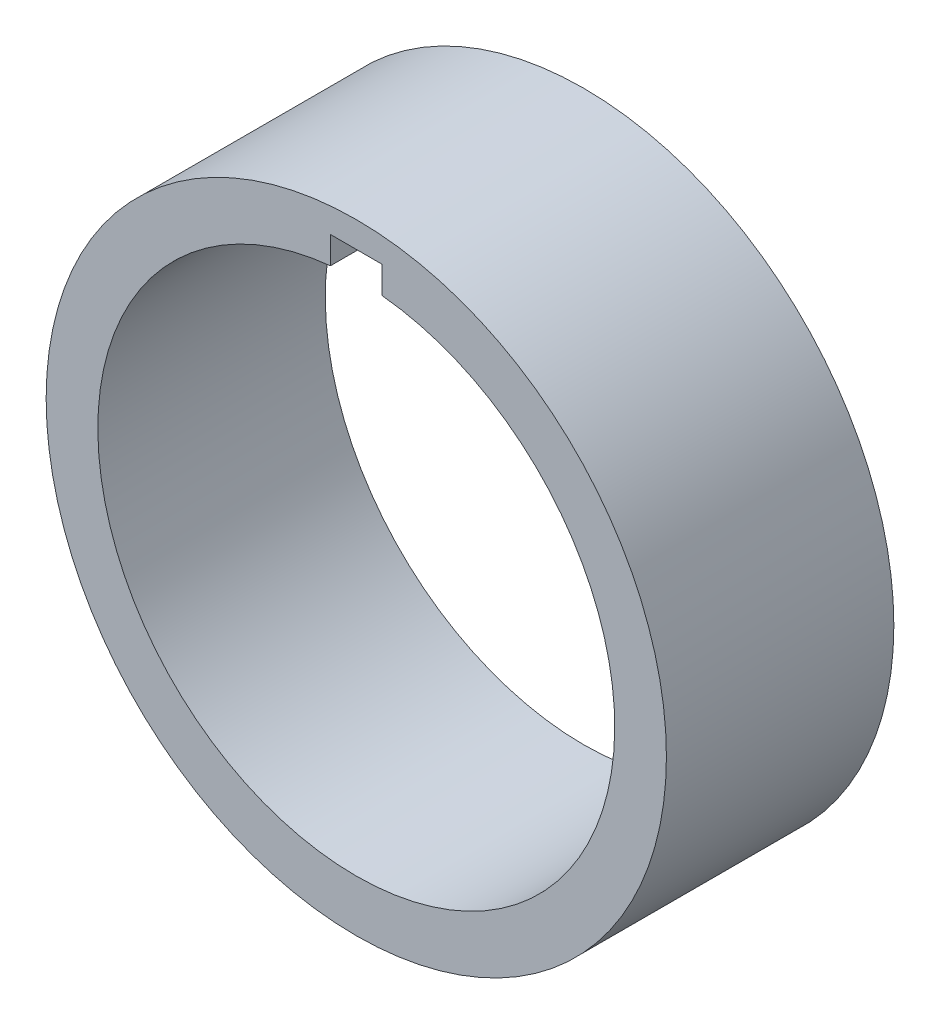
from build123d import *

# Parameters (mm, degrees)
SKETCH1_R           = 30
BOSS_EXTRUDE1_DEPTH = 22


with BuildPart() as part:
    # Sketch1 → Boss-Extrude1 (new body)
    with BuildSketch(Plane.XY):
        Circle(SKETCH1_R)
        with BuildLine():
            Line((-2.5, 24.874685928), (-2.5, 27.5))
            Line((-2.5, 27.5), (2.5, 27.5))
            Line((2.5, 27.5), (2.5, 24.874685928))
            ThreePointArc((2.5, 24.874685928), (0, -25), (-2.5, 24.874685928))
        make_face(mode=Mode.SUBTRACT)
    extrude(amount=BOSS_EXTRUDE1_DEPTH)


solid = part.part
